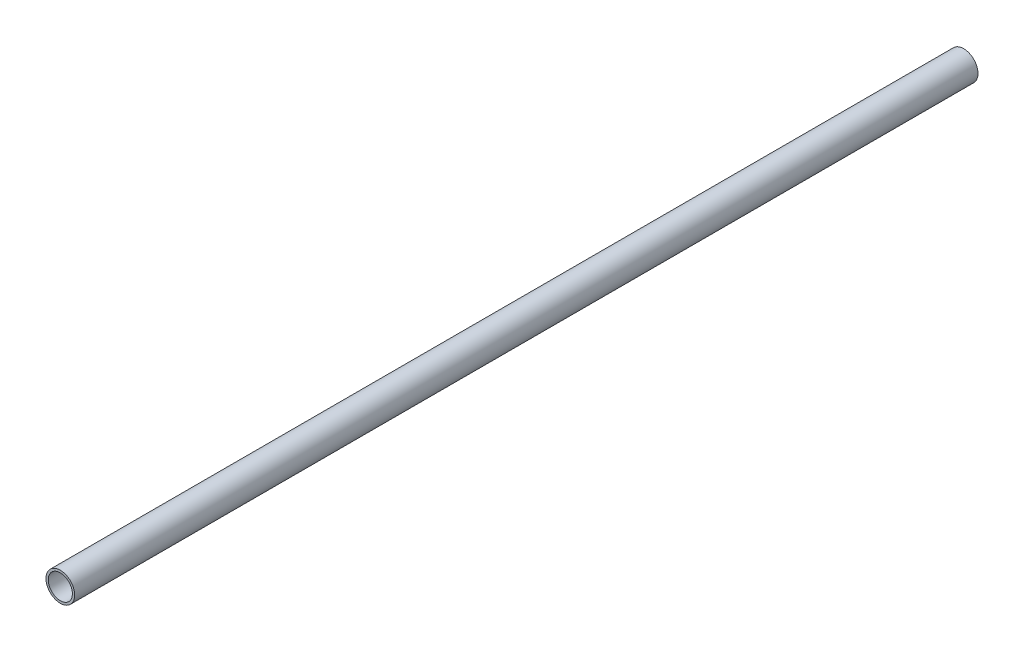
from build123d import *

# Parameters (mm, degrees)
SKETCH1_R           = 6.35
SKETCH1_R_2         = 5.35
BOSS_EXTRUDE1_DEPTH = 400


with BuildPart() as part:
    # Sketch1 → Boss-Extrude1 (new body)
    with BuildSketch(Plane.XY):
        Circle(SKETCH1_R)
        Circle(SKETCH1_R_2, mode=Mode.SUBTRACT)
    extrude(amount=BOSS_EXTRUDE1_DEPTH)


solid = part.part
